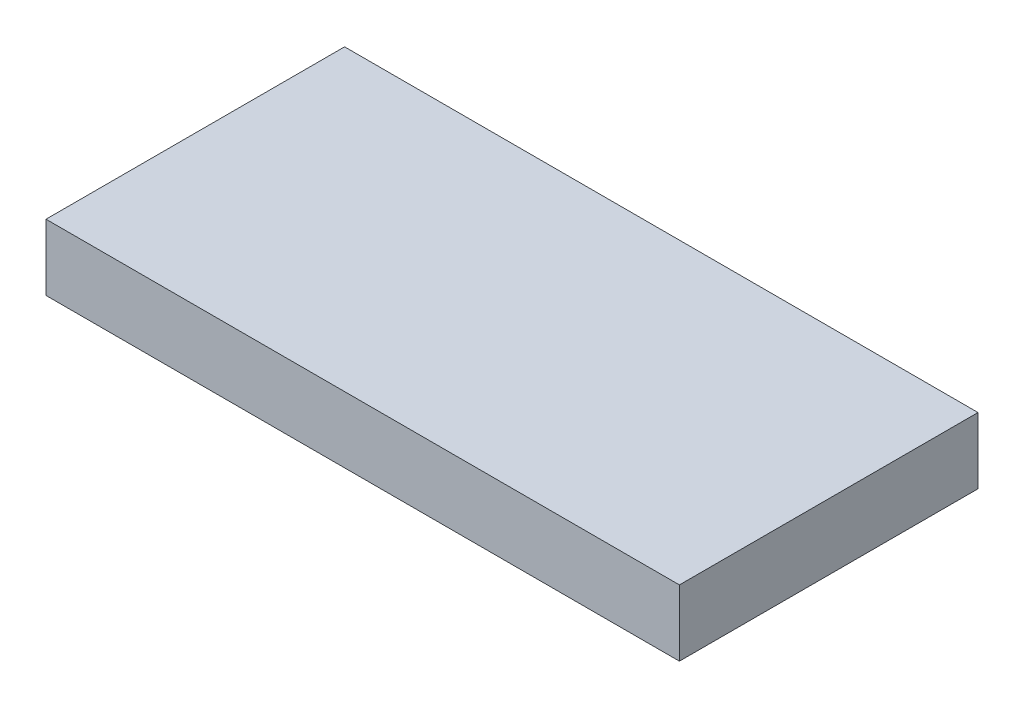
from build123d import *

# Parameters (mm, degrees)
SKETCH1_W           = 95.878650751
SKETCH1_H           = 45.196528152
BOSS_EXTRUDE1_DEPTH = 10


with BuildPart() as part:
    # Sketch1 → Boss-Extrude1 (new body)
    with BuildSketch(Plane(origin=(0, 0, 0), x_dir=(1, 0, 0), z_dir=(0, 1, 0))):
        with Locations((47.939325376, -22.598264076)):
            Rectangle(SKETCH1_W, SKETCH1_H)
    extrude(amount=BOSS_EXTRUDE1_DEPTH)


solid = part.part
